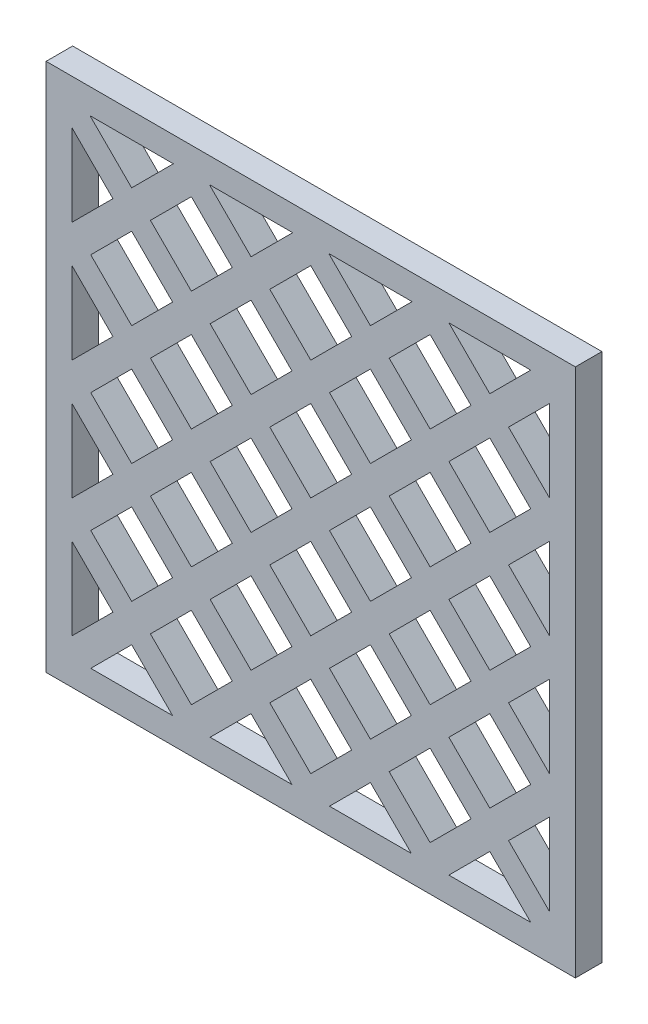
from build123d import *

# Parameters (mm, degrees)
SKETCH5_W           = 40
SKETCH5_H           = 40
BOSS_EXTRUDE2_DEPTH = 2
CUT_EXTRUDE1_DEPTH  = 2
CUT_EXTRUDE4_DEPTH  = 2
CUT_EXTRUDE5_DEPTH  = 2
CUT_EXTRUDE6_DEPTH  = 2
CUT_EXTRUDE7_DEPTH  = 2
CUT_EXTRUDE8_DEPTH  = 2
SKETCH6_OUTSIDE_W   = 53.32
SKETCH6_OUTSIDE_H   = 53.32
SKETCH6_OUTSIDE_W_2 = 39.9
SKETCH6_OUTSIDE_H_2 = 39.9
CUT_EXTRUDE9_DEPTH  = 10


with BuildPart() as part:
    # Sketch5 → Boss-Extrude2 (new body)
    with BuildSketch(Plane.XY):
        Rectangle(SKETCH5_W, SKETCH5_H)
    extrude(amount=BOSS_EXTRUDE2_DEPTH)

    # Sketch4 → Cut-Extrude1 (cut)
    with BuildSketch(Plane.XY):
        Polygon((16.585786438, 18.056847711), (10.414213562, 18.056847711), (13.5, 14.971061274), align=None)
        Polygon((18, 10.414213562), (18, 16.585786438), (14.914213562, 13.5), align=None)
    extrude(amount=CUT_EXTRUDE1_DEPTH, mode=Mode.SUBTRACT)

    # Sketch4<5> → Cut-Extrude4 (cut)
    with BuildSketch(Plane.XY):
        Polygon((-13.5, -14.914213562), (-16.585786438, -18), (-10.414213562, -18), align=None)
        Polygon((-13.5, -12.085786438), (-10.414213562, -9), (-13.5, -5.914213562), (-16.585786438, -9), align=None)
        Polygon((-5.914213562, -13.5), (-9, -10.414213562), (-12.085786438, -13.5), (-9, -16.585786438), align=None)
        Polygon((-18, -16.585786438), (-14.914213562, -13.5), (-18, -10.414213562), align=None)
    extrude(amount=CUT_EXTRUDE4_DEPTH, mode=Mode.SUBTRACT)

    # Sketch4<6> → Cut-Extrude5 (cut)
    with BuildSketch(Plane.XY):
        Polygon((13.5, -14.914213562), (10.414213562, -18), (16.585786438, -18), align=None)
        Polygon((3.085786438, -13.5), (0, -10.414213562), (-3.085786438, -13.5), (0, -16.585786438), align=None)
        Polygon((-1.414213562, -18), (-4.5, -14.914213562), (-7.585786438, -18), align=None)
        Polygon((4.5, -5.914213562), (1.414213562, -9), (4.5, -12.085786438), (7.585786438, -9), align=None)
        Polygon((12.085786438, -13.5), (9, -10.414213562), (5.914213562, -13.5), (9, -16.585786438), align=None)
        Polygon((7.585786438, -18), (4.5, -14.914213562), (1.414213562, -18), align=None)
        Polygon((13.5, -5.914213562), (10.414213562, -9), (13.5, -12.085786438), (16.585786438, -9), align=None)
        Polygon((18, -16.585786438), (18, -10.414213562), (14.914213562, -13.5), align=None)
        Polygon((12.085786438, -4.5), (9, -1.414213562), (5.914213562, -4.5), (9, -7.585786438), align=None)
        Polygon((18, -7.585786438), (18, -1.414213562), (14.914213562, -4.5), align=None)
    extrude(amount=CUT_EXTRUDE5_DEPTH, mode=Mode.SUBTRACT)

    # Sketch4<7> → Cut-Extrude6 (cut)
    with BuildSketch(Plane.XY):
        Polygon((-4.5, -5.914213562), (-7.585786438, -9), (-4.5, -12.085786438), (-1.414213562, -9), align=None)
        Polygon((3.085786438, -4.5), (0, -1.414213562), (-3.085786438, -4.5), (0, -7.585786438), align=None)
        Polygon((4.5, 3.085786438), (1.414213562, 0), (4.5, -3.085786438), (7.585786438, 0), align=None)
        Polygon((13.5, 3.085786438), (10.414213562, 0), (13.5, -3.085786438), (16.585786438, 0), align=None)
        Polygon((3.085786438, 4.5), (0, 7.585786438), (-3.085786438, 4.5), (0, 1.414213562), align=None)
        Polygon((4.5, 12.085786438), (1.414213562, 9), (4.5, 5.914213562), (7.585786438, 9), align=None)
        Polygon((12.085786438, 4.5), (9, 7.585786438), (5.914213562, 4.5), (9, 1.414213562), align=None)
        Polygon((13.5, 12.085786438), (10.414213562, 9), (13.5, 5.914213562), (16.585786438, 9), align=None)
        Polygon((18, 1.414213562), (18, 7.585786438), (14.914213562, 4.5), align=None)
        Polygon((3.085786438, 13.5), (0, 16.585786438), (-3.085786438, 13.5), (0, 10.414213562), align=None)
        Polygon((7.642634149, 18.056847711), (1.357365851, 18.056847711), (4.5, 14.914213562), align=None)
        Polygon((12.085786438, 13.5), (9, 16.585786438), (5.914213562, 13.5), (9, 10.414213562), align=None)
    extrude(amount=CUT_EXTRUDE6_DEPTH, mode=Mode.SUBTRACT)

    # Sketch4<9> → Cut-Extrude7 (cut)
    with BuildSketch(Plane.XY):
        Polygon((-9, -7.585786438), (-5.914213562, -4.5), (-9, -1.414213562), (-12.085786438, -4.5), align=None)
        Polygon((-4.5, 3.085786438), (-7.585786438, 0), (-4.5, -3.085786438), (-1.414213562, 0), align=None)
        Polygon((-9, 1.414213562), (-5.914213562, 4.5), (-9, 7.585786438), (-12.085786438, 4.5), align=None)
        Polygon((-18, -7.585786438), (-14.914213562, -4.5), (-18, -1.414213562), align=None)
        Polygon((-13.5, 3.085786438), (-16.585786438, 0), (-13.5, -3.085786438), (-10.414213562, 0), align=None)
        Polygon((-18, 1.414213562), (-14.914213562, 4.5), (-18, 7.585786438), align=None)
    extrude(amount=CUT_EXTRUDE7_DEPTH, mode=Mode.SUBTRACT)

    # Sketch4<10> → Cut-Extrude8 (cut)
    with BuildSketch(Plane.XY):
        Polygon((-10.357365851, 18.056847711), (-16.642634149, 18.056847711), (-13.5, 14.914213562), align=None)
        Polygon((-14.914213562, 13.5), (-18, 16.585786438), (-18, 10.414213562), align=None)
        Polygon((-4.5, 12.085786438), (-7.585786438, 9), (-4.5, 5.914213562), (-1.414213562, 9), align=None)
        Polygon((-9, 10.414213562), (-5.914213562, 13.5), (-9, 16.585786438), (-12.085786438, 13.5), align=None)
        Polygon((-1.357365851, 18.056847711), (-7.642634149, 18.056847711), (-4.5, 14.914213562), align=None)
        Polygon((-13.5, 12.085786438), (-16.585786438, 9), (-13.5, 5.914213562), (-10.414213562, 9), align=None)
    extrude(amount=CUT_EXTRUDE8_DEPTH, mode=Mode.SUBTRACT)

    # Sketch6 outside → Cut-Extrude9 (cut)
    with BuildSketch(Plane(origin=(0, 0, 0), x_dir=(-1, 0, 0), z_dir=(0, 0, -1))):
        Rectangle(SKETCH6_OUTSIDE_W, SKETCH6_OUTSIDE_H)
        Rectangle(SKETCH6_OUTSIDE_W_2, SKETCH6_OUTSIDE_H_2, mode=Mode.SUBTRACT)
    extrude(amount=-CUT_EXTRUDE9_DEPTH, mode=Mode.SUBTRACT)


solid = part.part
